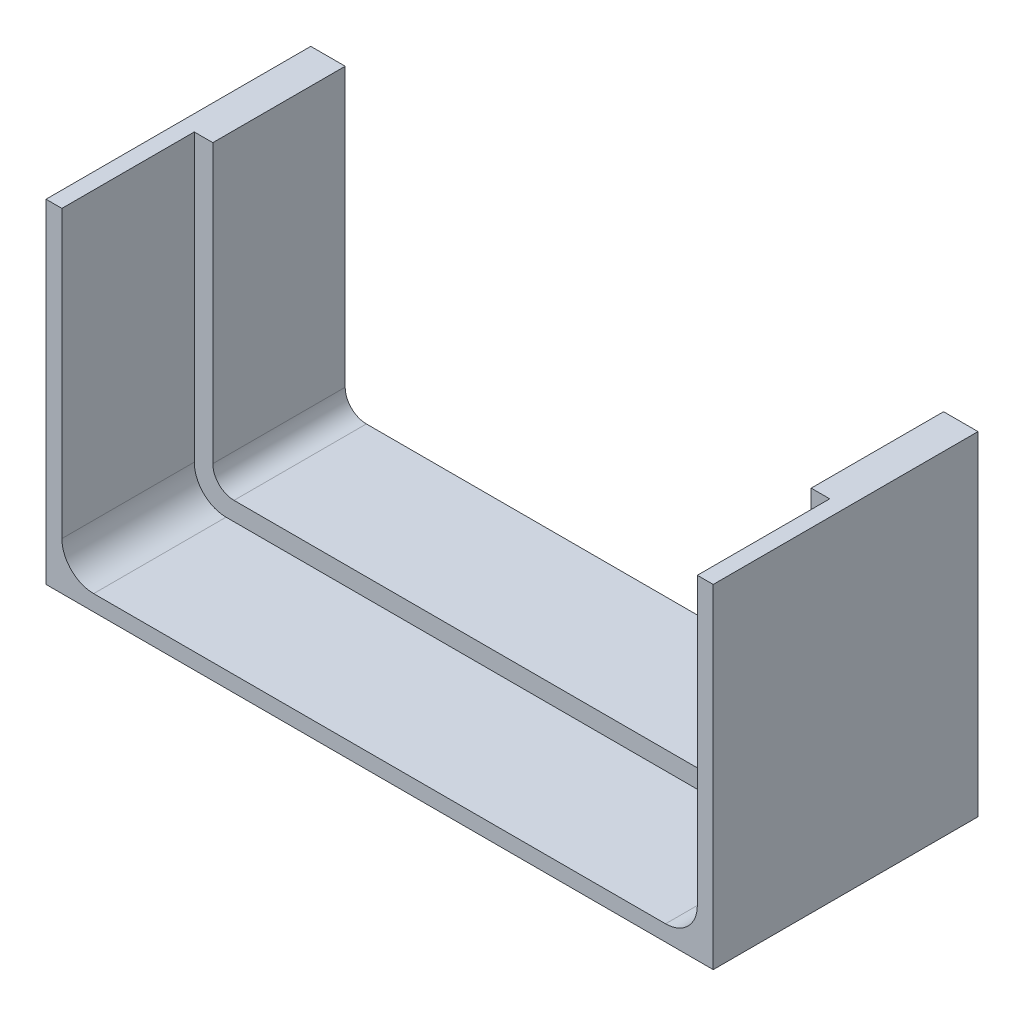
from build123d import *

# Parameters (mm, degrees)
BOSS_EXTRUDE1_DEPTH = 25
FILLET1_R           = 6
BOSS_EXTRUDE2_DEPTH = 25
FILLET2_R           = 4


with BuildPart() as part:
    # Sketch2 → Boss-Extrude1 (new body)
    with BuildSketch(Plane.XY):
        Polygon((-63, 0), (-60, 0), (-60, -60), (60, -60), (60, 0), (63, 0), (63, -63), (-63, -63), align=None)
    extrude(amount=BOSS_EXTRUDE1_DEPTH)

    # Fillet1
    fillet1_edges = [part.edges().sort_by_distance(p)[0] for p in [
        (-60, -60, 12.5),
        (60, -60, 12.5),
    ]]
    fillet(fillet1_edges, radius=FILLET1_R)

    # Sketch3 → Boss-Extrude2 (add)
    with BuildSketch(Plane(origin=(0, 0, 0), x_dir=(-1, 0, 0), z_dir=(0, 0, -1))):
        Polygon((63, -63), (63, 0), (56.5, 0), (56.5, -56.5), (-56.5, -56.5), (-56.5, 0), (-63, 0), (-63, -63), align=None)
    extrude(amount=BOSS_EXTRUDE2_DEPTH)

    # Fillet2
    fillet2_edges = [part.edges().sort_by_distance(p)[0] for p in [
        (-56.5, -56.5, -12.5),
        (56.5, -56.5, -12.5),
    ]]
    fillet(fillet2_edges, radius=FILLET2_R)


solid = part.part
